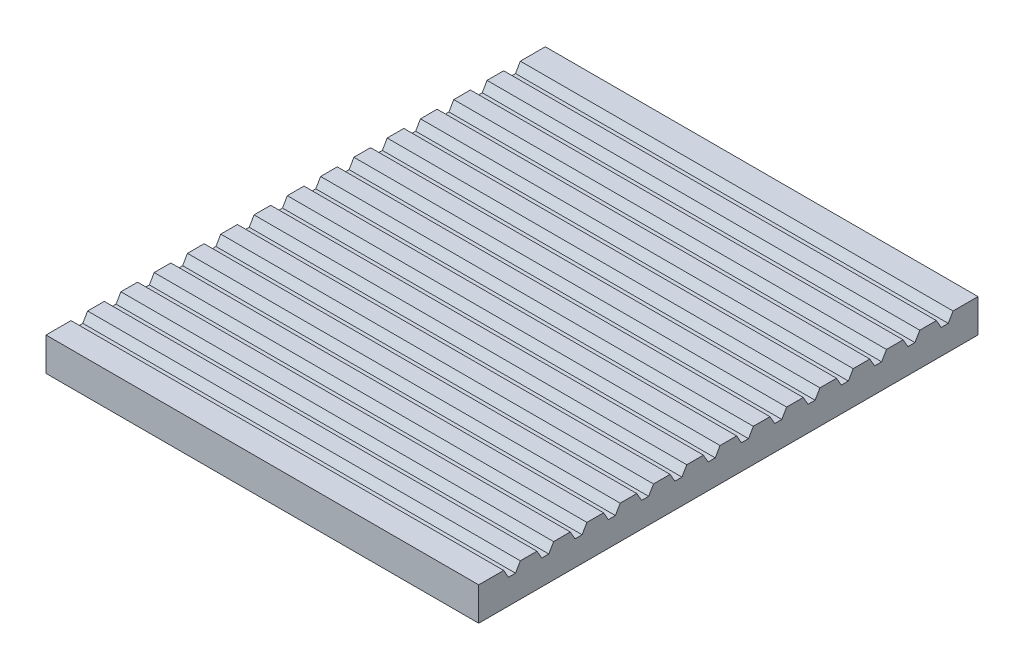
from build123d import *

# Parameters (mm, degrees)
SKETCH2_W           = 330.2
SKETCH2_H           = 381
BOSS_EXTRUDE1_DEPTH = 25.4
CUT_EXTRUDE1_DEPTH  = 505.815015625


with BuildPart() as part:
    # Sketch2 → Boss-Extrude1 (new body)
    with BuildSketch(Plane(origin=(0, 0, 0), x_dir=(1, 0, 0), z_dir=(0, 1, 0))):
        with Locations((165.1, -190.5)):
            Rectangle(SKETCH2_W, SKETCH2_H)
    extrude(amount=BOSS_EXTRUDE1_DEPTH)

    # Sketch3 → Cut-Extrude1 (cut, through all)
    with BuildSketch(Plane(origin=(330.2, 0, 0), x_dir=(0, 0, -1), z_dir=(1, 0, 0))):
        Polygon((-361.95, 25.4), (-358.283825791, 19.05), (-352.916174209, 19.05), (-349.25, 25.4), align=None)
        Polygon((-323.85, 25.4), (-336.55, 25.4), (-332.883825791, 19.05), (-327.516174209, 19.05), align=None)
        Polygon((-298.45, 25.4), (-311.15, 25.4), (-307.483825791, 19.05), (-302.116174209, 19.05), align=None)
        Polygon((-273.05, 25.4), (-285.75, 25.4), (-282.083825791, 19.05), (-276.716174209, 19.05), align=None)
        Polygon((-247.65, 25.4), (-260.35, 25.4), (-256.683825791, 19.05), (-251.316174209, 19.05), align=None)
        Polygon((-222.25, 25.4), (-234.95, 25.4), (-231.283825791, 19.05), (-225.916174209, 19.05), align=None)
        Polygon((-196.85, 25.4), (-209.55, 25.4), (-205.883825791, 19.05), (-200.516174209, 19.05), align=None)
        Polygon((-171.45, 25.4), (-184.15, 25.4), (-180.483825791, 19.05), (-175.116174209, 19.05), align=None)
        Polygon((-146.05, 25.4), (-158.75, 25.4), (-155.083825791, 19.05), (-149.716174209, 19.05), align=None)
        Polygon((-120.65, 25.4), (-133.35, 25.4), (-129.683825791, 19.05), (-124.316174209, 19.05), align=None)
        Polygon((-95.25, 25.4), (-107.95, 25.4), (-104.283825791, 19.05), (-98.916174209, 19.05), align=None)
        Polygon((-69.85, 25.4), (-82.55, 25.4), (-78.883825791, 19.05), (-73.516174209, 19.05), align=None)
        Polygon((-44.45, 25.4), (-57.15, 25.4), (-53.483825791, 19.05), (-48.116174209, 19.05), align=None)
        Polygon((-19.05, 25.4), (-31.75, 25.4), (-28.083825791, 19.05), (-22.716174209, 19.05), align=None)
    extrude(amount=-CUT_EXTRUDE1_DEPTH, mode=Mode.SUBTRACT)


solid = part.part
